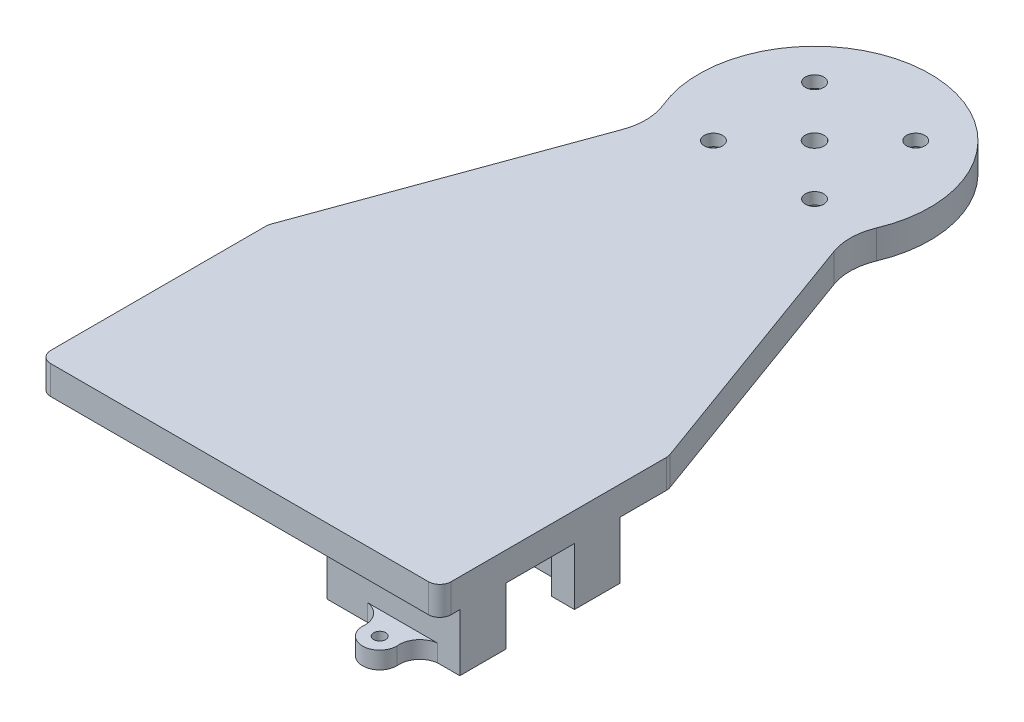
from build123d import *

# Parameters (mm, degrees)
BOSS_EXTRUDE4_DEPTH     = 5
SKETCH11_W              = 70
SKETCH11_H              = 5
BOSS_EXTRUDE5_DEPTH     = 40
FILLET1_R               = 10
FILLET2_R               = 10
SKETCH21_R              = 1.6
CUT_EXTRUDE1_DEPTH      = 131.853043071
CIRPATTERN1_COUNT       = 4
SKETCH22_R              = 2.86
CUT_EXTRUDE2_DEPTH      = 2.95
CIRPATTERN2_COUNT       = 4
FILLET4_R               = 2
SKETCH25_W              = 19
SKETCH25_H              = 10
BOSS_EXTRUDE6_DEPTH     = 4
CUT_EXTRUDE4_DEPTH      = 9.5
CUT_EXTRUDE4_DEPTH_BACK = 5.5
SKETCH26_W              = 11.1
SKETCH26_H              = 12
BOSS_EXTRUDE9_DEPTH     = 1.5
BOSS_EXTRUDE10_DEPTH    = 10
SKETCH35_W              = 10.92028557
SKETCH35_H              = 17.996185279
BOSS_EXTRUDE11_DEPTH    = 2.4
BOSS_EXTRUDE12_DEPTH    = 3
SKETCH37_R              = 1.05
CUT_EXTRUDE6_DEPTH      = 3
SKETCH39_R              = 1.65
CUT_EXTRUDE7_DEPTH      = 135.508959181
SKETCH40_W              = 4
SKETCH40_H              = 19
CUT_EXTRUDE8_DEPTH      = 5.5


with BuildPart() as part:
    # Sketch9 → Boss-Extrude4 (new body)
    with BuildSketch(Plane(origin=(0, 0, 0), x_dir=(1, 0, 0), z_dir=(0, 1, 0))):
        with BuildLine():
            Line((-35, -85.986185279), (35, -85.986185279))
            Line((35, -85.986185279), (16.969019665, -36.446473957))
            ThreePointArc((16.969019665, -36.446473957), (0, -5.285305191), (-16.969019665, -36.446473957))
            Line((-16.969019665, -36.446473957), (-35, -85.986185279))
        make_face()
    extrude(amount=BOSS_EXTRUDE4_DEPTH)

    # Sketch11 → Boss-Extrude5 (add)
    with BuildSketch(Plane.XY.offset(85.986185279)):
        with Locations((0, 2.5)):
            Rectangle(SKETCH11_W, SKETCH11_H)
    extrude(amount=BOSS_EXTRUDE5_DEPTH)

    # Fillet1
    fillet1_edges = [part.edges().sort_by_distance(p)[0] for p in [
        (-16.969019665, 2.5, 36.446473957),
    ]]
    fillet(fillet1_edges, radius=FILLET1_R)

    # Fillet2
    fillet2_edges = [part.edges().sort_by_distance(p)[0] for p in [
        (16.969019665, 2.5, 36.446473957),
    ]]
    fillet(fillet2_edges, radius=FILLET2_R)

    # Sketch21 → Cut-Extrude1 (cut, through all)
    with BuildSketch(Plane(origin=(0, 0, 0), x_dir=(-1, 0, 0), z_dir=(0, -1, 0))):
        with Locations(Location((8.838834765, -16.647350514, 0), (0, 0, 90))):
            Circle(SKETCH21_R)
    cut_extrude1 = extrude(amount=-CUT_EXTRUDE1_DEPTH, mode=Mode.SUBTRACT)

    # CirPattern1: Cut-Extrude1 ×4 about axis
    cirpattern1_axis = Axis((0, 0, 25.486185279), (0, 1, 0))
    for i in range(1, CIRPATTERN1_COUNT):
        add(cut_extrude1.rotate(cirpattern1_axis, i * 360 / CIRPATTERN1_COUNT), mode=Mode.SUBTRACT)

    # Sketch22 → Cut-Extrude2 (cut)
    with BuildSketch(Plane(origin=(0, 0, 0), x_dir=(-1, 0, 0), z_dir=(0, -1, 0))):
        with Locations(Location((8.838834765, -16.647350514, 0), (0, 0, 90))):
            Circle(SKETCH22_R)
    cut_extrude2 = extrude(amount=-CUT_EXTRUDE2_DEPTH, mode=Mode.SUBTRACT)

    # CirPattern2: Cut-Extrude2 ×4 about axis
    cirpattern2_axis = Axis((0, 0, 25.486185279), (0, 1, 0))
    for i in range(1, CIRPATTERN2_COUNT):
        add(cut_extrude2.rotate(cirpattern2_axis, i * 360 / CIRPATTERN2_COUNT), mode=Mode.SUBTRACT)

    # Fillet4
    fillet4_edges = [part.edges().sort_by_distance(p)[0] for p in [
        (35, 2.5, 125.986185279),
        (-35, 2.5, 125.986185279),
        (35, 2.5, 85.986185279),
        (-35, 2.5, 85.986185279),
    ]]
    fillet(fillet4_edges, radius=FILLET4_R)

    # Sketch25 → Boss-Extrude6 (add)
    with BuildSketch(Plane(origin=(-35, 0, -0.505457993), x_dir=(0, 0, -1), z_dir=(1, 0, 0))):
        with Locations((-108.99, -5)):
            Rectangle(SKETCH25_W, SKETCH25_H)
    extrude(amount=BOSS_EXTRUDE6_DEPTH)

    # Sketch26 → Cut-Extrude4 (cut, two sides: drawn at the far end of the back side and taken through both)
    with BuildSketch(Plane(origin=(-31, 0, -0.505457993), x_dir=(0, 0, -1), z_dir=(1, 0, 0)).offset(-CUT_EXTRUDE4_DEPTH_BACK)):
        with Locations((-108.99, -10)):
            Rectangle(SKETCH26_W, SKETCH26_H)
    extrude(amount=CUT_EXTRUDE4_DEPTH + CUT_EXTRUDE4_DEPTH_BACK, mode=Mode.SUBTRACT)

    # Sketch31 → Boss-Extrude9 (add)
    with BuildSketch(Plane(origin=(-31, 0, 0), x_dir=(0, 0, -1), z_dir=(1, 0, 0))):
        Polygon((-99.484542007, -4), (-102.934542007, -4), (-102.934542007, -4.5), (-98.984542007, -4.5), (-98.984542007, 0), (-117.984542007, 0), (-117.984542007, -4.5), (-114.034542007, -4.5), (-114.034542007, -4), (-117.484542007, -4), (-117.484542007, -2.4), (-99.484542007, -2.4), align=None)
    extrude(amount=BOSS_EXTRUDE9_DEPTH)

    # Sketch32 → Boss-Extrude10 (add)
    with BuildSketch(Plane.XZ):
        Polygon((31, 99.49), (31, 102.447343342), (35, 102.447343342), (35, 94.49), (20.07971443, 94.49), (11.750844515, 94.49), (11.750844515, 99.49), align=None)
        Polygon((31, 117.486185279), (31, 114.375323916), (35, 114.375323916), (35, 122.486185279), (20.07971443, 122.486185279), (11.750844515, 122.486185279), (11.750844515, 117.486185279), align=None)
    extrude(amount=BOSS_EXTRUDE10_DEPTH)

    # Sketch35 → Boss-Extrude11 (add)
    with BuildSketch(Plane(origin=(0, 0, 0), x_dir=(-1, 0, 0), z_dir=(0, -1, 0))):
        with Locations((-25.539857215, -108.48809264)):
            Rectangle(SKETCH35_W, SKETCH35_H)
    extrude(amount=BOSS_EXTRUDE11_DEPTH)

    # Sketch36 → Boss-Extrude12 (add)
    with BuildSketch(Plane.XZ.offset(10)):
        with BuildLine():
            ThreePointArc((22.024925014, 126.104087017), (24.995762953, 123.490002992), (27.97397303, 126.095684876))
            ThreePointArc((27.97397303, 126.095684876), (27.981571922, 126.293199831), (28, 126.49))
            ThreePointArc((28, 126.49), (25, 129.49), (22, 126.49))
            ThreePointArc((22, 126.49), (22.017642345, 126.297378059), (22.024925014, 126.104087017))
        make_face()
        with BuildLine():
            Line((18.846010194, 122.486185279), (31.109279434, 122.486185279))
            ThreePointArc((31.109279434, 122.486185279), (28.855912346, 123.695305938), (27.97397303, 126.095684876))
            ThreePointArc((27.97397303, 126.095684876), (24.995762953, 123.490002992), (22.024925014, 126.104087017))
            ThreePointArc((22.024925014, 126.104087017), (21.128493018, 123.68620066), (18.846010194, 122.486185279))
        make_face()
        with BuildLine():
            ThreePointArc((28, 90.49), (27.981571922, 90.686800169), (27.97397303, 90.884315124))
            ThreePointArc((27.97397303, 90.884315124), (24.995762953, 93.489997008), (22.024925014, 90.875912983))
            ThreePointArc((22.024925014, 90.875912983), (22.017642345, 90.682621941), (22, 90.49))
            ThreePointArc((22, 90.49), (25, 87.49), (28, 90.49))
        make_face()
        with BuildLine():
            ThreePointArc((27.97397303, 90.884315124), (28.855912346, 93.284694062), (31.109279434, 94.493814721))
            Line((31.109279434, 94.493814721), (18.846010194, 94.493814721))
            ThreePointArc((18.846010194, 94.493814721), (21.128493018, 93.29379934), (22.024925014, 90.875912983))
            ThreePointArc((22.024925014, 90.875912983), (24.995762953, 93.489997008), (27.97397303, 90.884315124))
        make_face()
    extrude(amount=-BOSS_EXTRUDE12_DEPTH)

    # Sketch37 → Cut-Extrude6 (cut)
    with BuildSketch(Plane(origin=(0, -10, 0), x_dir=(-1, 0, 0), z_dir=(0, -1, 0))):
        with Locations(Location((-25, -126.49, 0), (0, 0, 90))):
            Circle(SKETCH37_R)
        with Locations(Location((-25, -90.49, 0), (0, 0, 270))):
            Circle(SKETCH37_R)
    extrude(amount=-CUT_EXTRUDE6_DEPTH, mode=Mode.SUBTRACT)

    # Sketch39 → Cut-Extrude7 (cut, through all)
    with BuildSketch(Plane(origin=(0, 0, 0), x_dir=(-1, 0, 0), z_dir=(0, -1, 0))):
        with Locations(Location((0, -25.486185279, 0), (0, 0, 90))):
            Circle(SKETCH39_R)
    extrude(amount=-CUT_EXTRUDE7_DEPTH, mode=Mode.SUBTRACT)

    # Sketch40 → Cut-Extrude8 (cut)
    with BuildSketch(Plane(origin=(0, -10, 0), x_dir=(-1, 0, 0), z_dir=(0, -1, 0))):
        with Locations((33, -108.484542007)):
            Rectangle(SKETCH40_W, SKETCH40_H)
    extrude(amount=-CUT_EXTRUDE8_DEPTH, mode=Mode.SUBTRACT)


solid = part.part
